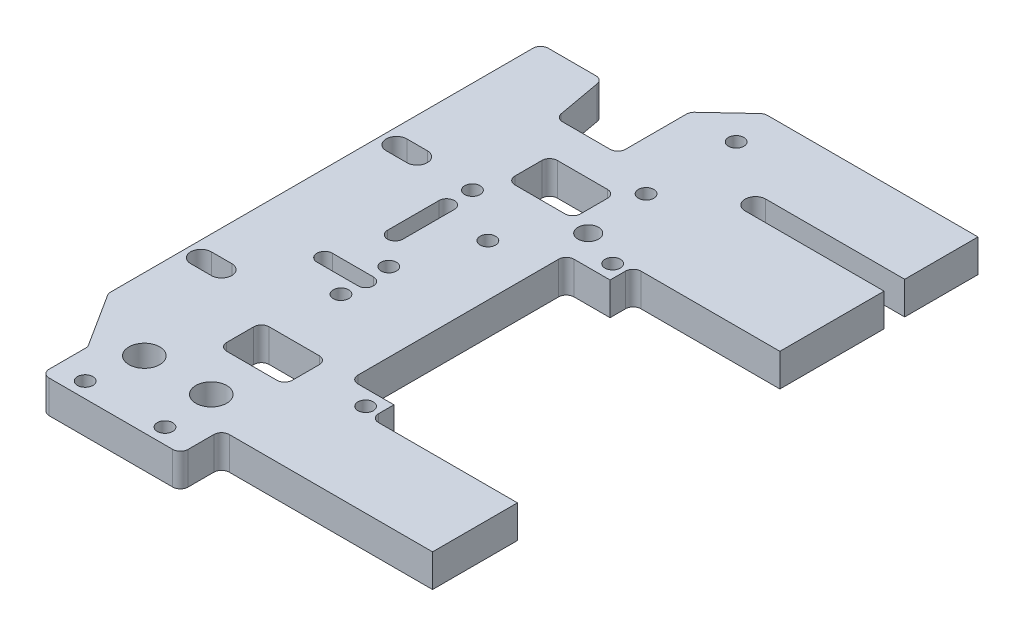
from build123d import *

# Parameters (mm, degrees)
SKETCH1_R           = 1.5
SKETCH1_R_2         = 3
SKETCH1_R_3         = 2
SKETCH1_W           = 12.75
SKETCH1_H           = 8.25
BOSS_EXTRUDE1_DEPTH = 6.35
FILLET1_R           = 1.5
SKETCH3_W           = 129.678218063
SKETCH3_H           = 13.276015012
CUT_EXTRUDE1_DEPTH  = 56
SKETCH4_W           = 14.25
SKETCH4_H           = 6.35
SKETCH4_W_2         = 20.25
SKETCH4_W_3         = 16.5
BOSS_EXTRUDE2_DEPTH = 25
SKETCH5_W           = 158.83803675
SKETCH5_H           = 69.224935419
CUT_EXTRUDE2_DEPTH  = 86


with BuildPart() as part:
    # Sketch1 → Boss-Extrude1 (new body)
    with BuildSketch(Plane(origin=(0, 0, 0), x_dir=(1, 0, 0), z_dir=(0, 1, 0))):
        Polygon((0, 20), (0, 104), (12, 104), (14, 93), (26, 93), (26, 107), (33.5, 114), (62.5, 114), (70, 107), (70, 93), (82, 93), (84, 104), (96, 104), (96, 20), (89, 9), (89, 0), (62, 0), (62, 8), (34, 8), (34, 0), (7, 0), (7, 9), align=None)
        with Locations(Location((12.5, 3, 0), (0, 0, 270))):
            Circle(SKETCH1_R, mode=Mode.SUBTRACT)
        with Locations(Location((28, 3, 0), (0, 0, 270))):
            Circle(SKETCH1_R, mode=Mode.SUBTRACT)
        with Locations(Location((68, 3, 0), (0, 0, 90))):
            Circle(SKETCH1_R, mode=Mode.SUBTRACT)
        with Locations(Location((83.5, 3, 0), (0, 0, 90))):
            Circle(SKETCH1_R, mode=Mode.SUBTRACT)
        with Locations(Location((14, 13, 0), (0, 0, 270))):
            Circle(SKETCH1_R_2, mode=Mode.SUBTRACT)
        with Locations(Location((27, 13, 0), (0, 0, 270))):
            Circle(SKETCH1_R_2, mode=Mode.SUBTRACT)
        with Locations(Location((69, 13, 0), (0, 0, 90))):
            Circle(SKETCH1_R_2, mode=Mode.SUBTRACT)
        with Locations(Location((82, 13, 0), (0, 0, 90))):
            Circle(SKETCH1_R_2, mode=Mode.SUBTRACT)
        with Locations(Location((22.75, 42.455027657, 0), (0, 0, 270))):
            Circle(SKETCH1_R, mode=Mode.SUBTRACT)
        with Locations(Location((22.75, 51.751081058, 0), (0, 0, 270))):
            Circle(SKETCH1_R, mode=Mode.SUBTRACT)
        with Locations(Location((73.25, 42.455027657, 0), (0, 0, 90))):
            Circle(SKETCH1_R, mode=Mode.SUBTRACT)
        with Locations(Location((73.25, 51.751081058, 0), (0, 0, 90))):
            Circle(SKETCH1_R, mode=Mode.SUBTRACT)
        with Locations(Location((18, 72.75, 0), (0, 0, 270))):
            Circle(SKETCH1_R, mode=Mode.SUBTRACT)
        with Locations(Location((28, 65.75, 0), (0, 0, 270))):
            Circle(SKETCH1_R, mode=Mode.SUBTRACT)
        with Locations(Location((68, 65.75, 0), (0, 0, 90))):
            Circle(SKETCH1_R, mode=Mode.SUBTRACT)
        with Locations(Location((78, 72.75, 0), (0, 0, 90))):
            Circle(SKETCH1_R, mode=Mode.SUBTRACT)
        with Locations(Location((36.5, 76.75, 0), (0, 0, 270))):
            Circle(SKETCH1_R_3, mode=Mode.SUBTRACT)
        with Locations(Location((59.5, 76.75, 0), (0, 0, 90))):
            Circle(SKETCH1_R_3, mode=Mode.SUBTRACT)
        with Locations(Location((35.5, 89, 0), (0, 0, 270))):
            Circle(SKETCH1_R, mode=Mode.SUBTRACT)
        with Locations(Location((35.5, 106.5, 0), (0, 0, 270))):
            Circle(SKETCH1_R, mode=Mode.SUBTRACT)
        with Locations(Location((60.5, 89, 0), (0, 0, 90))):
            Circle(SKETCH1_R, mode=Mode.SUBTRACT)
        with Locations(Location((60.5, 106.5, 0), (0, 0, 90))):
            Circle(SKETCH1_R, mode=Mode.SUBTRACT)
        with Locations(Location((44, 26, 0), (0, 0, 270))):
            Circle(SKETCH1_R, mode=Mode.SUBTRACT)
        with Locations(Location((52, 26, 0), (0, 0, 90))):
            Circle(SKETCH1_R, mode=Mode.SUBTRACT)
        with Locations(Location((52, 74, 0), (0, 0, 270))):
            Circle(SKETCH1_R, mode=Mode.SUBTRACT)
        with Locations(Location((44, 74, 0), (0, 0, 90))):
            Circle(SKETCH1_R, mode=Mode.SUBTRACT)
        with Locations(Location((48, 97.75, 0), (0, 0, 270))):
            Circle(SKETCH1_R_3, mode=Mode.SUBTRACT)
        with Locations((69.875, 25.875)):
            Rectangle(SKETCH1_W, SKETCH1_H, mode=Mode.SUBTRACT)
        with Locations((26.125, 25.875)):
            Rectangle(SKETCH1_W, SKETCH1_H, mode=Mode.SUBTRACT)
        with Locations((69.875, 81.875)):
            Rectangle(SKETCH1_W, SKETCH1_H, mode=Mode.SUBTRACT)
        with Locations((26.125, 81.875)):
            Rectangle(SKETCH1_W, SKETCH1_H, mode=Mode.SUBTRACT)
        with BuildLine():
            Line((3, 75), (7, 75))
            ThreePointArc((7, 75), (9, 73), (7, 71))
            Line((7, 71), (3, 71))
            ThreePointArc((3, 71), (1, 73), (3, 75))
        make_face(mode=Mode.SUBTRACT)
        with BuildLine():
            Line((93, 75), (89, 75))
            ThreePointArc((89, 75), (87, 73), (89, 71))
            Line((89, 71), (93, 71))
            ThreePointArc((93, 71), (95, 73), (93, 75))
        make_face(mode=Mode.SUBTRACT)
        with BuildLine():
            Line((93, 37), (89, 37))
            ThreePointArc((89, 37), (87, 35), (89, 33))
            Line((89, 33), (93, 33))
            ThreePointArc((93, 33), (95, 35), (93, 37))
        make_face(mode=Mode.SUBTRACT)
        with BuildLine():
            Line((3, 33), (7, 33))
            ThreePointArc((7, 33), (9, 35), (7, 37))
            Line((7, 37), (3, 37))
            ThreePointArc((3, 37), (1, 35), (3, 33))
        make_face(mode=Mode.SUBTRACT)
        with BuildLine():
            Line((15, 48.525154469), (23, 48.525154469))
            ThreePointArc((23, 48.525154469), (24.5, 47.025154469), (23, 45.525154469))
            Line((23, 45.525154469), (15, 45.525154469))
            ThreePointArc((15, 45.525154469), (13.5, 47.025154469), (15, 48.525154469))
        make_face(mode=Mode.SUBTRACT)
        with BuildLine():
            Line((81, 48.525154469), (73, 48.525154469))
            ThreePointArc((73, 48.525154469), (71.5, 47.025154469), (73, 45.525154469))
            Line((73, 45.525154469), (81, 45.525154469))
            ThreePointArc((81, 45.525154469), (82.5, 47.025154469), (81, 48.525154469))
        make_face(mode=Mode.SUBTRACT)
        with BuildLine():
            Line((16.5, 67.75), (16.5, 57.75))
            ThreePointArc((16.5, 57.75), (18, 56.25), (19.5, 57.75))
            Line((19.5, 57.75), (19.5, 67.75))
            ThreePointArc((19.5, 67.75), (18, 69.25), (16.5, 67.75))
        make_face(mode=Mode.SUBTRACT)
        with BuildLine():
            Line((76.5, 67.75), (76.5, 57.75))
            ThreePointArc((76.5, 57.75), (78, 56.25), (79.5, 57.75))
            Line((79.5, 57.75), (79.5, 67.75))
            ThreePointArc((79.5, 67.75), (78, 69.25), (76.5, 67.75))
        make_face(mode=Mode.SUBTRACT)
        with BuildLine():
            Line((46.5, 29), (38, 29))
            Line((38, 29), (38, 71))
            Line((38, 71), (46.5, 71))
            Line((46.5, 71), (46.5, 74))
            ThreePointArc((46.5, 74), (48, 75.5), (49.5, 74))
            Line((49.5, 74), (49.5, 71))
            Line((49.5, 71), (58, 71))
            Line((58, 71), (58, 29))
            Line((58, 29), (49.5, 29))
            Line((49.5, 29), (49.5, 26))
            ThreePointArc((49.5, 26), (48, 24.5), (46.5, 26))
            Line((46.5, 26), (46.5, 29))
        make_face(mode=Mode.SUBTRACT)
    extrude(amount=BOSS_EXTRUDE1_DEPTH)

    # Fillet1
    fillet1_edges = [part.edges().sort_by_distance(p)[0] for p in [
        (19.75, 3.175, -30),
        (19.75, 3.175, -21.75),
        (32.5, 3.175, -21.75),
        (32.5, 3.175, -30),
        (63.5, 3.175, -77.75),
        (76.25, 3.175, -77.75),
        (76.25, 3.175, -86),
        (63.5, 3.175, -86),
        (19.75, 3.175, -86),
        (19.75, 3.175, -77.75),
        (32.5, 3.175, -77.75),
        (32.5, 3.175, -86),
        (58, 3.175, -29),
        (58, 3.175, -71),
        (38, 3.175, -71),
        (38, 3.175, -29),
        (62, 3.175, -8),
        (34, 3.175, -8),
        (34, 3.175, 0),
        (7, 3.175, 0),
        (7, 3.175, -9),
        (0, 3.175, -20),
        (0, 3.175, -104),
        (12, 3.175, -104),
        (14, 3.175, -93),
        (26, 3.175, -93),
        (26, 3.175, -107),
        (33.5, 3.175, -114),
        (62.5, 3.175, -114),
        (70, 3.175, -107),
        (70, 3.175, -93),
        (82, 3.175, -93),
        (84, 3.175, -104),
        (96, 3.175, -104),
        (96, 3.175, -20),
        (89, 3.175, -9),
        (89, 3.175, 0),
        (62, 3.175, 0),
        (76.25, 3.175, -21.75),
        (76.25, 3.175, -30),
        (63.5, 3.175, -30),
        (63.5, 3.175, -21.75),
    ]]
    fillet(fillet1_edges, radius=FILLET1_R)

    # Sketch3 → Cut-Extrude1 (cut)
    with BuildSketch(Plane(origin=(48, 0, 0), x_dir=(0, 0, -1), z_dir=(1, 0, 0))):
        with Locations((58.42243018, 0.940732076)):
            Rectangle(SKETCH3_W, SKETCH3_H)
    extrude(amount=CUT_EXTRUDE1_DEPTH, mode=Mode.SUBTRACT)

    # Sketch4 → Boss-Extrude2 (add)
    with BuildSketch(Plane(origin=(48, 0, 0), x_dir=(0, 0, -1), z_dir=(1, 0, 0))):
        with Locations((106.875, 3.175)):
            Rectangle(SKETCH4_W, SKETCH4_H)
        with Locations((85.625, 3.175)):
            Rectangle(SKETCH4_W_2, SKETCH4_H)
        with Locations((16.25, 3.175)):
            Rectangle(SKETCH4_W_3, SKETCH4_H)
    extrude(amount=BOSS_EXTRUDE2_DEPTH)

    # Mirror1: part across plane


with BuildPart() as part_1:
    add(part.part)
    add(part.part.mirror(Plane(origin=(73, 0, 0), x_dir=(0, 0, 1), z_dir=(1, 0, 0))))

    # Sketch5 → Cut-Extrude2 (cut)
    with BuildSketch(Plane(origin=(75, 0, 0), x_dir=(0, 0, -1), z_dir=(1, 0, 0))):
        with Locations((54.73207584, 3.767679241)):
            Rectangle(SKETCH5_W, SKETCH5_H)
    extrude(amount=CUT_EXTRUDE2_DEPTH, mode=Mode.SUBTRACT)


solid = part_1.part
